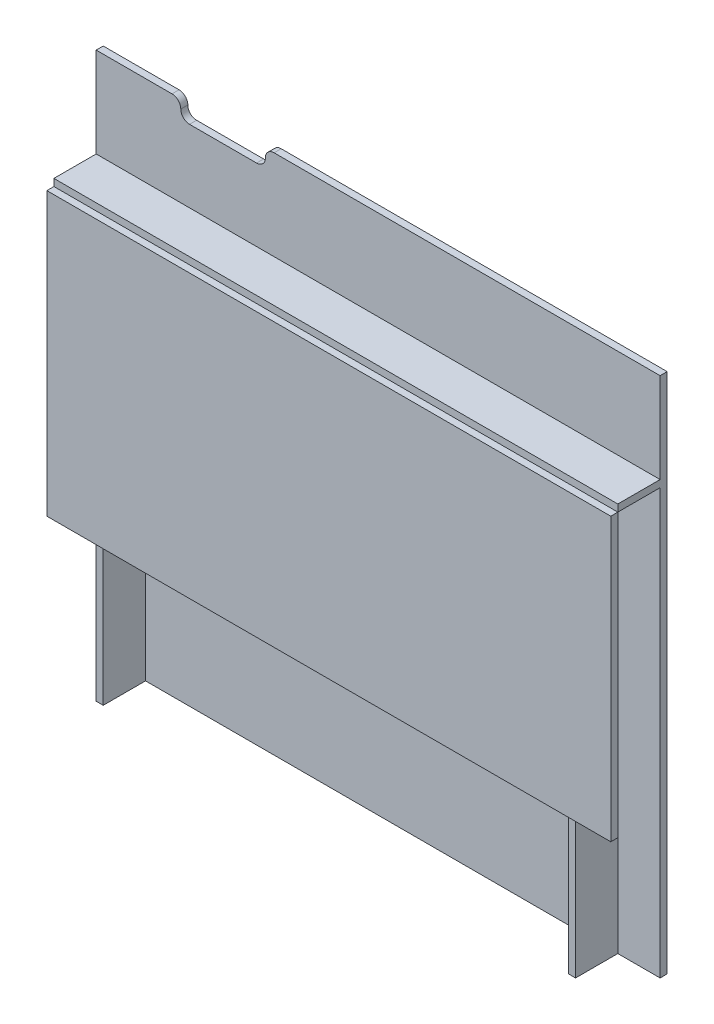
from build123d import *

# Parameters (mm, degrees)
SKETCH1_W           = 1016
SKETCH1_H           = 939.8
BOSS_EXTRUDE1_DEPTH = 12.7
SKETCH2_W           = 152.4
SKETCH2_H           = 31.75
CUT_EXTRUDE1_DEPTH  = 693.120870947
FILLET1_R           = 15.748
SKETCH4_W           = 1016
SKETCH4_H           = 12.7
BOSS_EXTRUDE2_DEPTH = 76.2
SKETCH5_W           = 12.7
SKETCH5_H           = 764.99923202
BOSS_EXTRUDE3_DEPTH = 76.2
SKETCH8_W           = 1016
SKETCH8_H           = 508
BOSS_EXTRUDE5_DEPTH = 12.7


with BuildPart() as part:
    # Sketch1 → Boss-Extrude1 (new body)
    with BuildSketch(Plane.XY):
        Rectangle(SKETCH1_W, SKETCH1_H)
    extrude(amount=BOSS_EXTRUDE1_DEPTH)

    # Sketch2 → Cut-Extrude1 (cut, through all)
    with BuildSketch(Plane(origin=(0, 0, 0), x_dir=(-1, 0, 0), z_dir=(0, 0, -1))):
        with Locations((279.4, 454.025)):
            Rectangle(SKETCH2_W, SKETCH2_H)
    extrude(amount=-CUT_EXTRUDE1_DEPTH, mode=Mode.SUBTRACT)

    # Fillet1
    fillet1_edges = [part.edges().sort_by_distance(p)[0] for p in [
        (-355.6, 469.9, 6.35),
        (-355.6, 438.15, 6.35),
        (-203.2, 438.15, 6.35),
        (-203.2, 469.9, 6.35),
    ]]
    fillet(fillet1_edges, radius=FILLET1_R)

    # Sketch4 → Boss-Extrude2 (add)
    with BuildSketch(Plane.XY.offset(12.7)):
        with Locations((0, 301.44923202)):
            Rectangle(SKETCH4_W, SKETCH4_H)
    extrude(amount=BOSS_EXTRUDE2_DEPTH)

    # Sketch5 → Boss-Extrude3 (add)
    with BuildSketch(Plane.XY.offset(12.7)):
        with Locations((-425.45, -87.40038399)):
            Rectangle(SKETCH5_W, SKETCH5_H)
        with Locations((425.45, -87.40038399)):
            Rectangle(SKETCH5_W, SKETCH5_H)
    extrude(amount=BOSS_EXTRUDE3_DEPTH)


with BuildPart() as body_2:
    # Sketch8 → Boss-Extrude5 (new body)
    with BuildSketch(Plane.XY.offset(88.9)):
        with Locations((0, 41.09923202)):
            Rectangle(SKETCH8_W, SKETCH8_H)
    extrude(amount=BOSS_EXTRUDE5_DEPTH)


solid = Compound([part.part, body_2.part])
